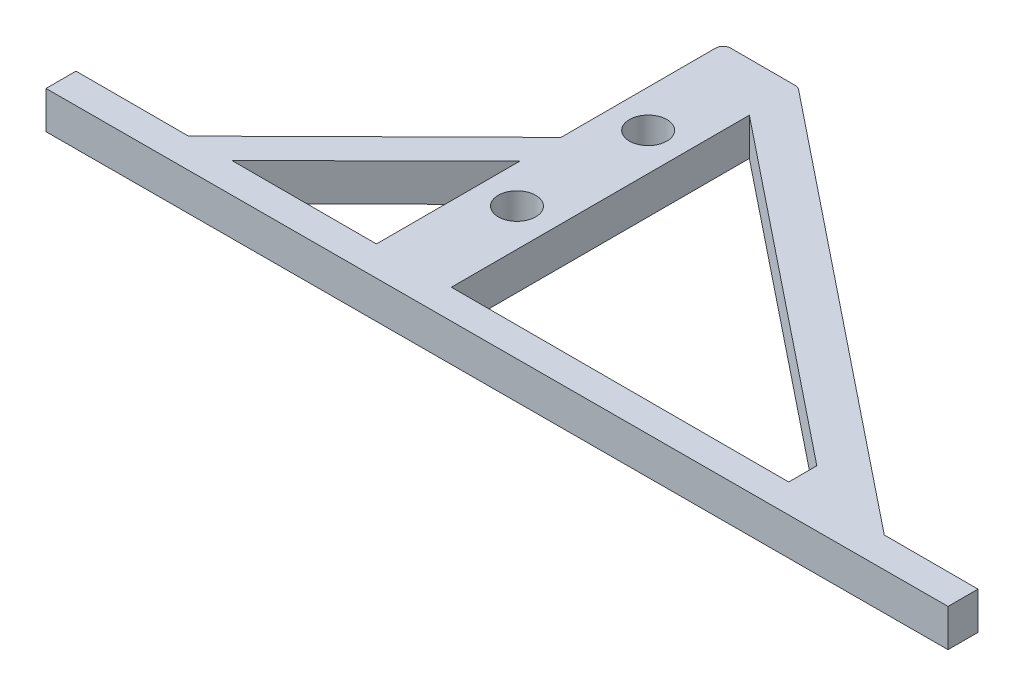
from build123d import *

# Parameters (mm, degrees)
SKETCH1_R           = 6.35
BOSS_EXTRUDE1_DEPTH = 12.7


with BuildPart() as part:
    # Sketch1 → Boss-Extrude1 (new body)
    with BuildSketch(Plane(origin=(0, 0, 0), x_dir=(1, 0, 0), z_dir=(0, 1, 0))):
        with BuildLine():
            Line((171.45, 10.16), (26.09574153, 126.443406776))
            ThreePointArc((26.09574153, 126.443406776), (25.34977374, 126.856815931), (24.509016109, 127))
            Line((24.509016109, 127), (2.54, 127))
            ThreePointArc((2.54, 127), (0.743948776, 126.256051224), (0, 124.46))
            Line((0, 124.46), (0, 72.055027479))
            Line((0, 72.055027479), (-63.5, 9.332908944))
            Line((-63.5, 9.332908944), (-101.6, 9.332908944))
            Line((-101.6, 9.332908944), (-101.6, -0.827091056))
            Line((-101.6, -0.827091056), (203.2, 0))
            Line((203.2, 0), (203.2, 10.16))
            Line((203.2, 10.16), (171.45, 10.16))
        make_face()
        with Locations(Location((12.7, 88.9, 0), (0, 0, 90))):
            Circle(SKETCH1_R, mode=Mode.SUBTRACT)
        with Locations(Location((12.7, 44.45, 0), (0, 0, 90))):
            Circle(SKETCH1_R, mode=Mode.SUBTRACT)
        Polygon((0, 9.525), (0, 58.085027479), (-48.962001116, 9.525), align=None, mode=Mode.SUBTRACT)
        Polygon((25.4, 9.525), (25.4, 110.49), (139.7, 19.05), (139.7, 9.525), align=None, mode=Mode.SUBTRACT)
    extrude(amount=BOSS_EXTRUDE1_DEPTH)


solid = part.part
